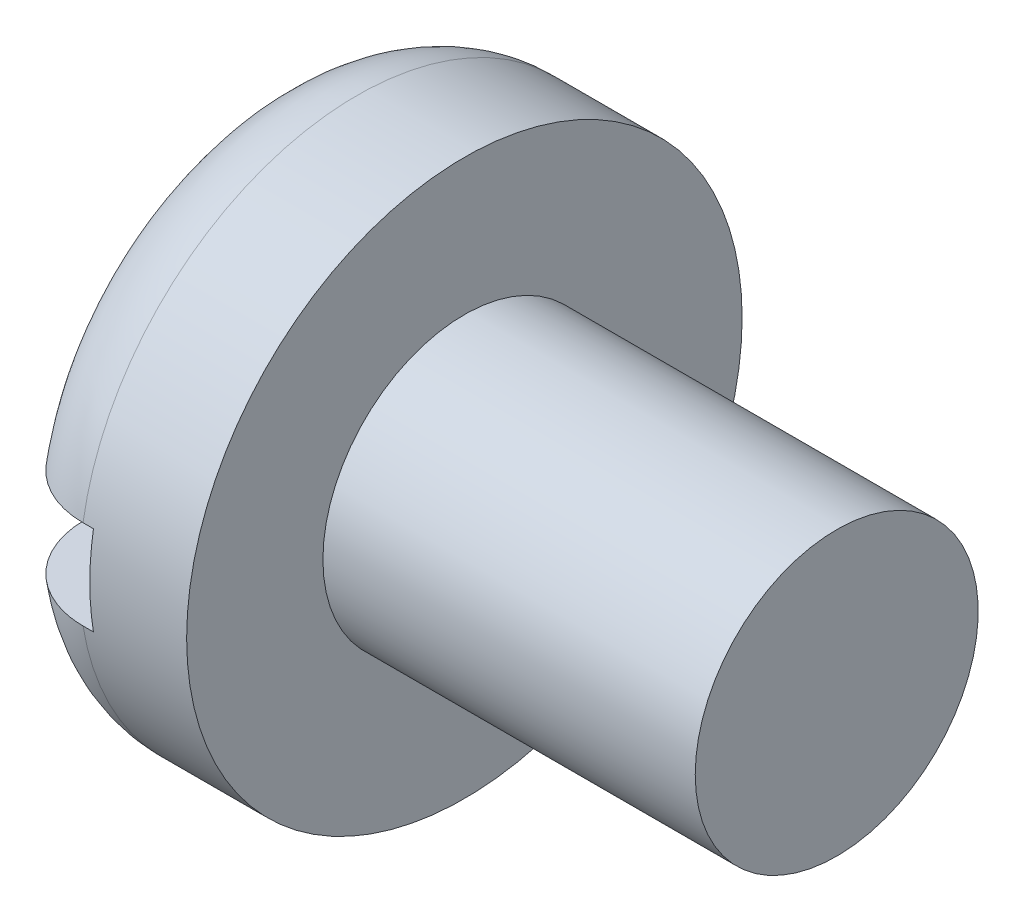
from build123d import *

# Parameters (mm, degrees)
SKETCH2_W  = 9.4742
SKETCH2_H  = 1.524
SLOT_DEPTH = 1.7272


with BuildPart() as part:
    # BodySke → Base-Revolve (revolve)
    with BuildSketch(Plane.XY, mode=Mode.PRIVATE) as base_revolve_sk:
        with BuildLine():
            Line((3.3782, 2.413), (3.3782, 4.7371))
            Line((3.3782, 4.7371), (1.5494, 4.7371))
            ThreePointArc((1.5494, 4.7371), (0.453808753, 4.283291247), (0, 3.1877))
            Line((0, 3.1877), (0, 0))
            Line((0, 0), (9.7282, 0))
            Line((9.7282, 0), (9.7282, 2.413))
            Line((9.7282, 2.413), (3.3782, 2.413))
        make_face()
    revolve(base_revolve_sk.sketch.rotate(Axis((-25.4, 0, 0), (1, 0, 0)), 90), axis=Axis((-25.4, 0, 0), (1, 0, 0)))

    # Sketch2 → Slot (cut)
    with BuildSketch(Plane(origin=(0, 0, 0), x_dir=(0, 0, -1), z_dir=(1, 0, 0))):
        Rectangle(SKETCH2_W, SKETCH2_H)
    extrude(amount=SLOT_DEPTH, mode=Mode.SUBTRACT)


solid = part.part
